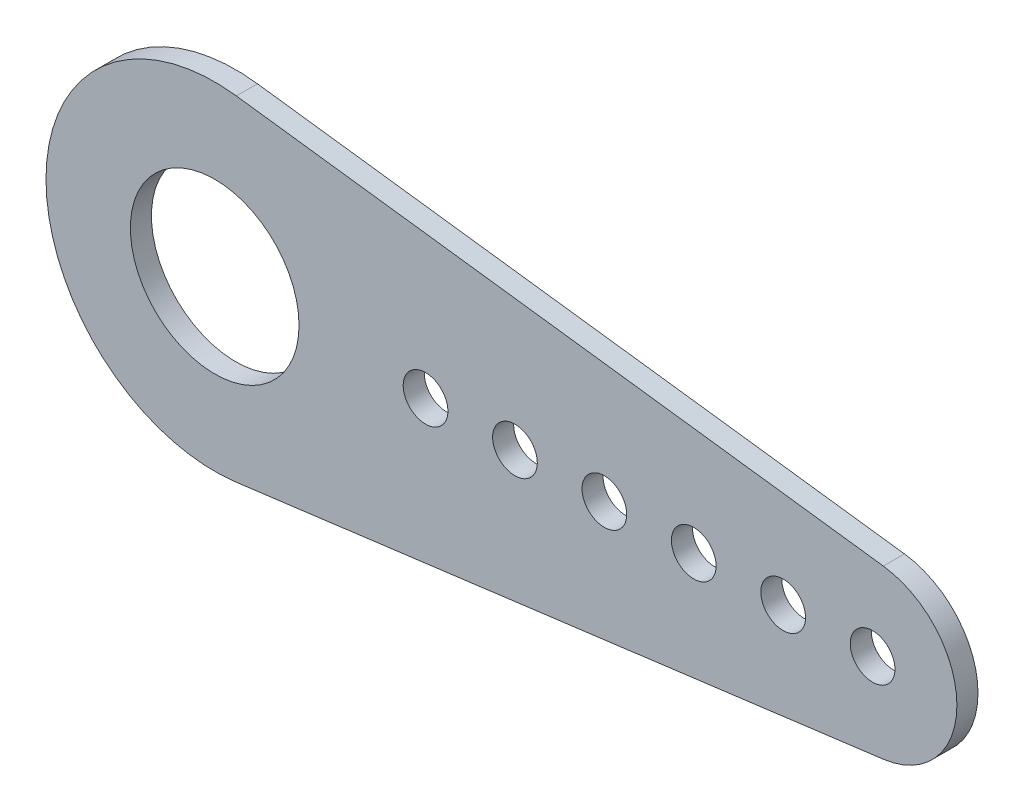
from build123d import *

# Parameters (mm, degrees)
FLAT_SKETCH_R           = 25.4
FLAT_SKETCH_R_2         = 12.7
FLAT_SKETCH_R_3         = 3.3655
EXTRUDE_FACE_DEPTH      = 3.175
FLAT_SKETCH_4_R         = 3.3655
EXTRUDE_CUT_HOLES_DEPTH = 3.175


with BuildPart() as part:
    # Flat sketch → Extrude face (new body)
    # profile 1 of 13: a face of its own
    with BuildSketch(Plane.XY):
        Circle(FLAT_SKETCH_R)
        Circle(FLAT_SKETCH_R_2, mode=Mode.SUBTRACT)
    # profile 2 of 13: a face of its own
    with BuildSketch(Plane.XY):
        with BuildLine():
            Line((100.688205128, 12.595195436), (3.256410256, 25.190390871))
            ThreePointArc((3.256410256, 25.190390871), (19.077117451, 16.769722411), (25.4, 0))
            ThreePointArc((25.4, 0), (19.077117451, -16.769722411), (3.256410256, -25.190390871))
            Line((3.256410256, -25.190390871), (100.688205128, -12.595195436))
            ThreePointArc((100.688205128, -12.595195436), (91.936966729, -10.514389997), (86.759121462, -3.158858528))
            ThreePointArc((86.759121462, -3.158858528), (82.2325, 0), (86.759121462, 3.158858528))
            ThreePointArc((86.759121462, 3.158858528), (91.936966729, 10.514389997), (100.688205128, 12.595195436))
        make_face()
        with Locations((31.75, 0)):
            Circle(FLAT_SKETCH_R_3, mode=Mode.SUBTRACT)
        with Locations((45.212, 0)):
            Circle(FLAT_SKETCH_R_3, mode=Mode.SUBTRACT)
        with Locations((58.674, 0)):
            Circle(FLAT_SKETCH_R_3, mode=Mode.SUBTRACT)
        with Locations((72.136, 0)):
            Circle(FLAT_SKETCH_R_3, mode=Mode.SUBTRACT)
    # profile 3 of 13: a face of its own
    with BuildSketch(Plane.XY):
        with Locations((31.75, 0)):
            Circle(FLAT_SKETCH_R_3)
    # profile 4 of 13: a face of its own
    with BuildSketch(Plane.XY):
        with Locations((45.212, 0)):
            Circle(FLAT_SKETCH_R_3)
    # profile 5 of 13: a face of its own
    with BuildSketch(Plane.XY):
        with Locations((58.674, 0)):
            Circle(FLAT_SKETCH_R_3)
    # profile 6 of 13: a face of its own
    with BuildSketch(Plane.XY):
        with Locations((72.136, 0)):
            Circle(FLAT_SKETCH_R_3)
    # profile 7 of 13: a face of its own
    with BuildSketch(Plane.XY):
        with Locations((99.06, 0)):
            Circle(FLAT_SKETCH_R_2)
    # profile 8 of 13: a face of its own
    with BuildSketch(Plane.XY):
        with Locations((85.598, 0)):
            Circle(FLAT_SKETCH_R_3)
    # profile 9 of 13: a face of its own
    with BuildSketch(Plane.XY):
        with Locations((85.598, 0)):
            Circle(FLAT_SKETCH_R_3)
    # profile 10 of 13: a face of its own
    with BuildSketch(Plane.XY):
        with Locations((99.06, 0)):
            Circle(FLAT_SKETCH_R_2)
    # profile 11 of 13: a face of its own
    with BuildSketch(Plane.XY):
        with Locations((99.06, 0)):
            Circle(FLAT_SKETCH_R_2)
        with Locations((99.06, 0)):
            Circle(FLAT_SKETCH_R_3, mode=Mode.SUBTRACT)
    # profile 12 of 13: a face of its own
    with BuildSketch(Plane.XY):
        with Locations((85.598, 0)):
            Circle(FLAT_SKETCH_R_3)
    # profile 13 of 13: a face of its own
    with BuildSketch(Plane.XY):
        with Locations((99.06, 0)):
            Circle(FLAT_SKETCH_R_3)
    extrude(amount=EXTRUDE_FACE_DEPTH)

    # Flat sketch<4> → Extrude cut - holes (cut)
    with BuildSketch(Plane.XY):
        with Locations((99.06, 0)):
            Circle(FLAT_SKETCH_4_R)
        with Locations((85.598, 0)):
            Circle(FLAT_SKETCH_4_R)
        with Locations((72.136, 0)):
            Circle(FLAT_SKETCH_4_R)
        with Locations((58.674, 0)):
            Circle(FLAT_SKETCH_4_R)
        with Locations((45.212, 0)):
            Circle(FLAT_SKETCH_4_R)
        with Locations((31.75, 0)):
            Circle(FLAT_SKETCH_4_R)
    extrude(amount=EXTRUDE_CUT_HOLES_DEPTH, mode=Mode.SUBTRACT)


solid = part.part
